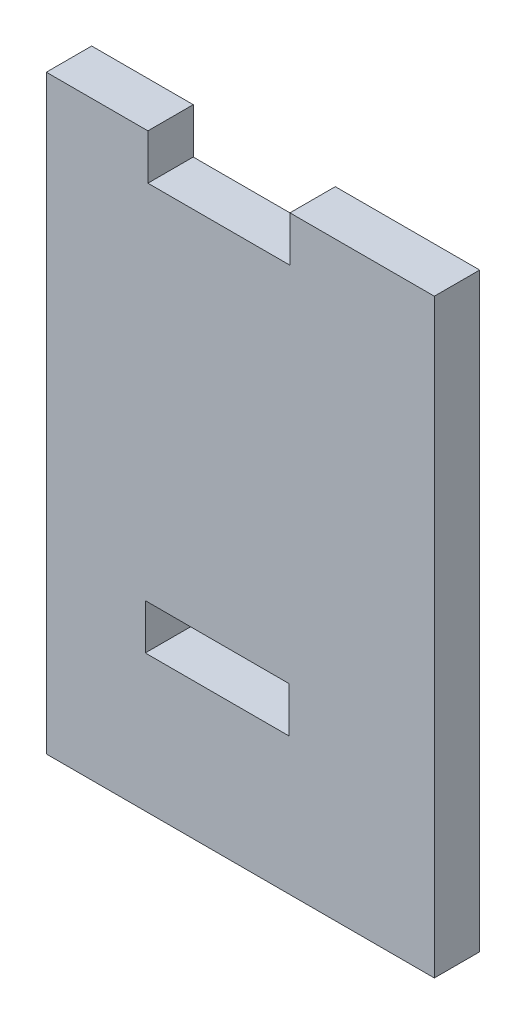
from build123d import *

# Parameters (mm, degrees)
SKETCH1_W           = 7.93
SKETCH1_H           = 2.5
BOSS_EXTRUDE1_DEPTH = 2.5


with BuildPart() as part:
    # Sketch1 → Boss-Extrude1 (new body)
    with BuildSketch(Plane.XY):
        Polygon((-10.695, 16.275), (-5.095, 16.275), (-5.095, 13.775), (2.735, 13.775), (2.735, 16.275), (10.695, 16.275), (10.695, -16.275), (-10.695, -16.275), align=None)
        with Locations((-1.275, -7.475)):
            Rectangle(SKETCH1_W, SKETCH1_H, mode=Mode.SUBTRACT)
    extrude(amount=BOSS_EXTRUDE1_DEPTH)


solid = part.part
